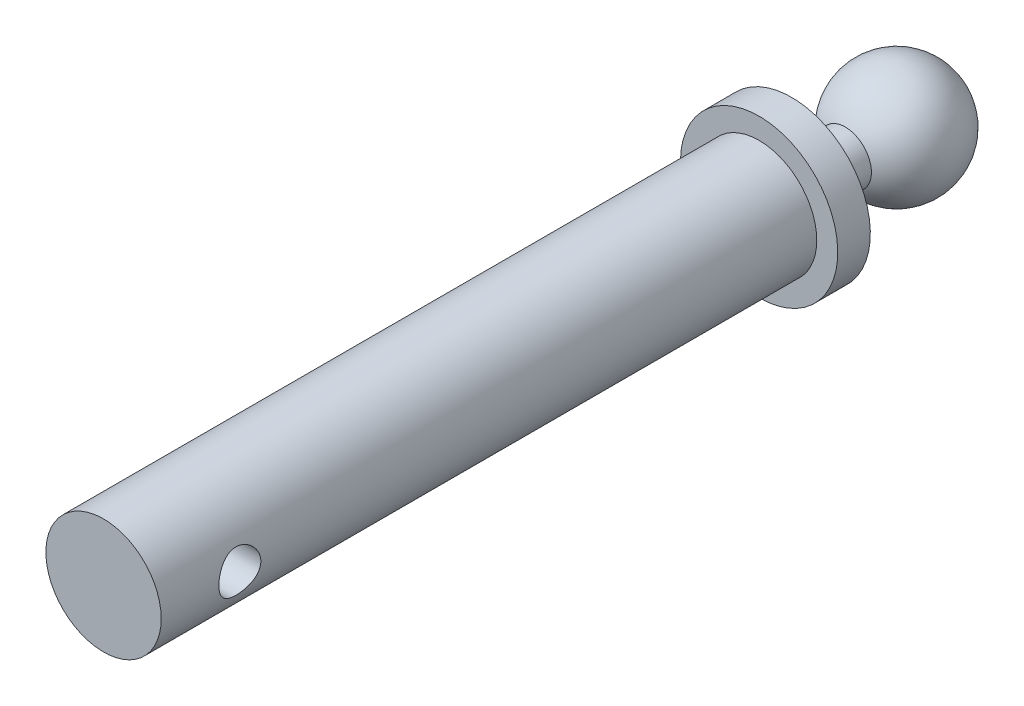
from build123d import *

# Parameters (mm, degrees)
RESSALTO_EXTRUS_O1_DEPTH      = 60
RESSALTO_EXTRUS_O1_DEPTH_BACK = 15
ESBO_O1_R                     = 5.497341607
CORTE_EXTRUS_O1_DEPTH         = 71
CORTE_EXTRUS_O1_DEPTH_BACK    = 71
ESBO_O2_R                     = 4
CORTE_EXTRUS_O3_DEPTH         = 64.97149057
CORTE_EXTRUS_O3_DEPTH_BACK    = 64.97149057
ESBO_O8_R                     = 2
RESSALTO_EXTRUS_O5_START      = -12
ESBO_O9_R                     = 7.5
RESSALTO_EXTRUS_O5_DEPTH      = 4
CORTE_EXTRUS_O5_DEPTH         = 65.872911801
ESBO_O12_R                    = 5.497341607
RESSALTO_EXTRUS_O6_DEPTH      = 3.5
ESBO_O14_R                    = 5.497341607
RESSALTO_EXTRUS_O7_DEPTH      = 6
CORTE_EXTRUS_O7_DEPTH         = 65.410749766
CORTE_EXTRUS_O7_DEPTH_BACK    = 65.410749766
ESBO_O16_R                    = 2
CORTE_EXTRUS_O8_DEPTH         = 65.410749766
CORTE_EXTRUS_O8_DEPTH_BACK    = 65.410749766
ESBO_O17_W                    = 10
ESBO_O17_H                    = 5.11854448
RESSALTO_EXTRUS_O8_START      = -14
RESSALTO_EXTRUS_O8_DEPTH      = 14
RESSALTO_EXTRUS_O9_START      = -1.79
RESSALTO_EXTRUS_O9_DEPTH      = 1.79
RESSALTO_EXTRUS_O10_DEPTH     = 2.21
ESBO_O21_R                    = 7.5
RESSALTO_EXTRUS_O11_DEPTH     = 3
CORTE_EXTRUS_O9_DEPTH         = 66.205232537
CORTE_EXTRUS_O9_DEPTH_BACK    = 66.205232537
ESBO_O22_W                    = 15
ESBO_O22_H                    = 25.435957471
ESBO_O23_R                    = 2.5
RESSALTO_EXTRUS_O12_DEPTH     = 10


with BuildPart() as part:
    # Esboço1 → Ressalto-extrusão1 (new, two sides: drawn at the far end of the back side and taken through both)
    with BuildSketch(Plane.XY.offset(-RESSALTO_EXTRUS_O1_DEPTH_BACK)):
        with Locations((15.99988667, 0)):
            Circle(ESBO_O1_R)
    extrude(amount=RESSALTO_EXTRUS_O1_DEPTH + RESSALTO_EXTRUS_O1_DEPTH_BACK)

    # Esboço2 → Corte-extrusão1 (cut, two sides: drawn at the far end of the back side and taken through both)
    with BuildSketch(Plane(origin=(0, 0, 0), x_dir=(0, 0, -1), z_dir=(1, 0, 0)).offset(-CORTE_EXTRUS_O1_DEPTH_BACK)):
        with Locations((-60, 0)):
            Circle(ESBO_O2_R)
    extrude(amount=CORTE_EXTRUS_O1_DEPTH + CORTE_EXTRUS_O1_DEPTH_BACK, mode=Mode.SUBTRACT)

    # Esboço8 → Corte-extrusão3 (cut, two sides: drawn at the far end of the back side and taken through both)
    with BuildSketch(Plane(origin=(0, 0, 0), x_dir=(0, 0, -1), z_dir=(1, 0, 0)).offset(-CORTE_EXTRUS_O3_DEPTH_BACK)):
        with Locations(Location((-52, 0, 0), (0, 0, 180))):
            Circle(ESBO_O8_R)
    extrude(amount=CORTE_EXTRUS_O3_DEPTH + CORTE_EXTRUS_O3_DEPTH_BACK, mode=Mode.SUBTRACT)

    # Esboço9 → Ressalto-extrusão5 (add)
    with BuildSketch(Plane(origin=(0, 0, -15), x_dir=(-1, 0, 0), z_dir=(0, 0, -1)).offset(RESSALTO_EXTRUS_O5_START)):
        with Locations((-15.99988667, 0)):
            Circle(ESBO_O9_R)
    extrude(amount=RESSALTO_EXTRUS_O5_DEPTH)

    # Esboço11 → Corte-extrusão5 (cut, through all)
    with BuildSketch(Plane(origin=(0, 0, 0), x_dir=(0, 0, -1), z_dir=(1, 0, 0))):
        Polygon((-56, -5.497341607), (-56, 0), (-56, 5.497341607), (-60, 5.497341607), (-60, 4), (-60, -5.497341607), align=None)
    extrude(amount=CORTE_EXTRUS_O5_DEPTH, mode=Mode.SUBTRACT)

    # Esboço12 → Ressalto-extrusão6 (add)
    with BuildSketch(Plane.XY.offset(56)):
        with Locations((15.99988667, 0)):
            Circle(ESBO_O12_R)
    extrude(amount=RESSALTO_EXTRUS_O6_DEPTH)

    # Esboço14 → Ressalto-extrusão7 (add)
    with BuildSketch(Plane(origin=(0, 0, -15), x_dir=(-1, 0, 0), z_dir=(0, 0, -1))):
        with Locations(Location((-15.99988667, 0, 0), (0, 0, 180))):
            Circle(ESBO_O14_R)
    extrude(amount=RESSALTO_EXTRUS_O7_DEPTH)

    # Esboço16 → Corte-extrusão7 (cut, two sides: drawn at the far end of the back side and taken through both)
    with BuildSketch(Plane(origin=(0, 0, 0), x_dir=(0, 0, -1), z_dir=(1, 0, 0)).offset(-CORTE_EXTRUS_O7_DEPTH_BACK)):
        with Locations((14.21, 0)):
            Circle(ESBO_O16_R)
    extrude(amount=CORTE_EXTRUS_O7_DEPTH + CORTE_EXTRUS_O7_DEPTH_BACK, mode=Mode.SUBTRACT)

    # Esboço17 → Corte-extrusão8 (cut, two sides: drawn at the far end of the back side and taken through both)
    with BuildSketch(Plane(origin=(0, 0, 0), x_dir=(0, 0, -1), z_dir=(1, 0, 0)).offset(-CORTE_EXTRUS_O8_DEPTH_BACK)):
        with Locations((14.21, -2.55927224)):
            Rectangle(ESBO_O17_W, ESBO_O17_H)
        with Locations((14.21, 2.55927224)):
            Rectangle(ESBO_O17_W, ESBO_O17_H)
    extrude(amount=CORTE_EXTRUS_O8_DEPTH + CORTE_EXTRUS_O8_DEPTH_BACK, mode=Mode.SUBTRACT)

    # Esboço18 → Ressalto-extrusão8 (add)
    with BuildSketch(Plane(origin=(0, 0, -21), x_dir=(-1, 0, 0), z_dir=(0, 0, -1)).offset(RESSALTO_EXTRUS_O8_START)):
        with BuildLine():
            Line((-21.481720524, 5.11854448), (-18.005196408, 5.11854448))
            ThreePointArc((-18.005196408, 5.11854448), (-15.99988667, 5.497341607), (-13.994576931, 5.11854448))
            Line((-13.994576931, 5.11854448), (-10.518052815, 5.11854448))
            ThreePointArc((-10.518052815, 5.11854448), (-15.99988667, 7.5), (-21.481720524, 5.11854448))
        make_face()
        with BuildLine():
            ThreePointArc((-13.994576931, -5.11854448), (-15.99988667, -5.497341607), (-18.005196408, -5.11854448))
            Line((-18.005196408, -5.11854448), (-21.481720524, -5.11854448))
            ThreePointArc((-21.481720524, -5.11854448), (-15.99988667, -7.5), (-10.518052815, -5.11854448))
            Line((-10.518052815, -5.11854448), (-13.994576931, -5.11854448))
        make_face()
    extrude(amount=RESSALTO_EXTRUS_O8_DEPTH)

    # Esboço19 → Ressalto-extrusão9 (add)
    with BuildSketch(Plane(origin=(0, 0, -21), x_dir=(-1, 0, 0), z_dir=(0, 0, -1)).offset(RESSALTO_EXTRUS_O9_START)):
        with BuildLine():
            ThreePointArc((-21.481720524, 5.11854448), (-23.49988667, 0), (-21.481720524, -5.11854448))
            Line((-21.481720524, -5.11854448), (-18.005196408, -5.11854448))
            ThreePointArc((-18.005196408, -5.11854448), (-21.497228276, 0), (-18.005196408, 5.11854448))
            Line((-18.005196408, 5.11854448), (-21.481720524, 5.11854448))
        make_face()
        with BuildLine():
            ThreePointArc((-10.518052815, -5.11854448), (-8.49988667, 0), (-10.518052815, 5.11854448))
            Line((-10.518052815, 5.11854448), (-13.994576931, 5.11854448))
            ThreePointArc((-13.994576931, 5.11854448), (-10.502545063, 0), (-13.994576931, -5.11854448))
            Line((-13.994576931, -5.11854448), (-10.518052815, -5.11854448))
        make_face()
    extrude(amount=RESSALTO_EXTRUS_O9_DEPTH)

    # Esboço20 → Ressalto-extrusão10 (add)
    with BuildSketch(Plane(origin=(0, 0, -7), x_dir=(-1, 0, 0), z_dir=(0, 0, -1))):
        with BuildLine():
            Line((-10.518052815, 5.11854448), (-13.994576931, 5.11854448))
            ThreePointArc((-13.994576931, 5.11854448), (-10.502545063, 0), (-13.994576931, -5.11854448))
            Line((-13.994576931, -5.11854448), (-10.518052815, -5.11854448))
            ThreePointArc((-10.518052815, -5.11854448), (-8.49988667, 0), (-10.518052815, 5.11854448))
        make_face()
        with BuildLine():
            Line((-18.005196408, 5.11854448), (-21.481720524, 5.11854448))
            ThreePointArc((-21.481720524, 5.11854448), (-23.49988667, 0), (-21.481720524, -5.11854448))
            Line((-21.481720524, -5.11854448), (-18.005196408, -5.11854448))
            ThreePointArc((-18.005196408, -5.11854448), (-21.497228276, 0), (-18.005196408, 5.11854448))
        make_face()
    extrude(amount=RESSALTO_EXTRUS_O10_DEPTH)

    # Esboço21 → Ressalto-extrusão11 (add)
    with BuildSketch(Plane(origin=(0, 0, -21), x_dir=(-1, 0, 0), z_dir=(0, 0, -1))):
        with Locations((-15.99988667, 0)):
            Circle(ESBO_O21_R)
    extrude(amount=RESSALTO_EXTRUS_O11_DEPTH)

    # Esboço22 → Corte-extrusão9 (cut, two sides: drawn at the far end of the back side and taken through both)
    with BuildSketch(Plane.XZ.offset(-5.11854448).offset(-CORTE_EXTRUS_O9_DEPTH_BACK)):
        with Locations((15.99988667, -18.822978736)):
            Rectangle(ESBO_O22_W, ESBO_O22_H)
    extrude(amount=CORTE_EXTRUS_O9_DEPTH + CORTE_EXTRUS_O9_DEPTH_BACK, mode=Mode.SUBTRACT)

    # Esboço23 → Ressalto-extrusão12 (add)
    with BuildSketch(Plane(origin=(0, 0, -6.105), x_dir=(-1, 0, 0), z_dir=(0, 0, -1))):
        with Locations(Location((-15.99988667, 0, 0), (0, 0, 90))):
            Circle(ESBO_O23_R)
    extrude(amount=RESSALTO_EXTRUS_O12_DEPTH)

    # Esboço24 → Revolução1 (revolve)
    with BuildSketch(Plane(origin=(0, 0, -16.105), x_dir=(-1, 0, 0), z_dir=(0, 0, -1))):
        with BuildLine():
            Line((-15.99988667, 5.497341607), (-15.99988667, -5.497341607))
            ThreePointArc((-15.99988667, -5.497341607), (-21.497228276, 0), (-15.99988667, 5.497341607))
        make_face()
    revolve(axis=Axis((15.99988667, 5.497341607, -16.105), (0, -1, 0)))


solid = part.part
